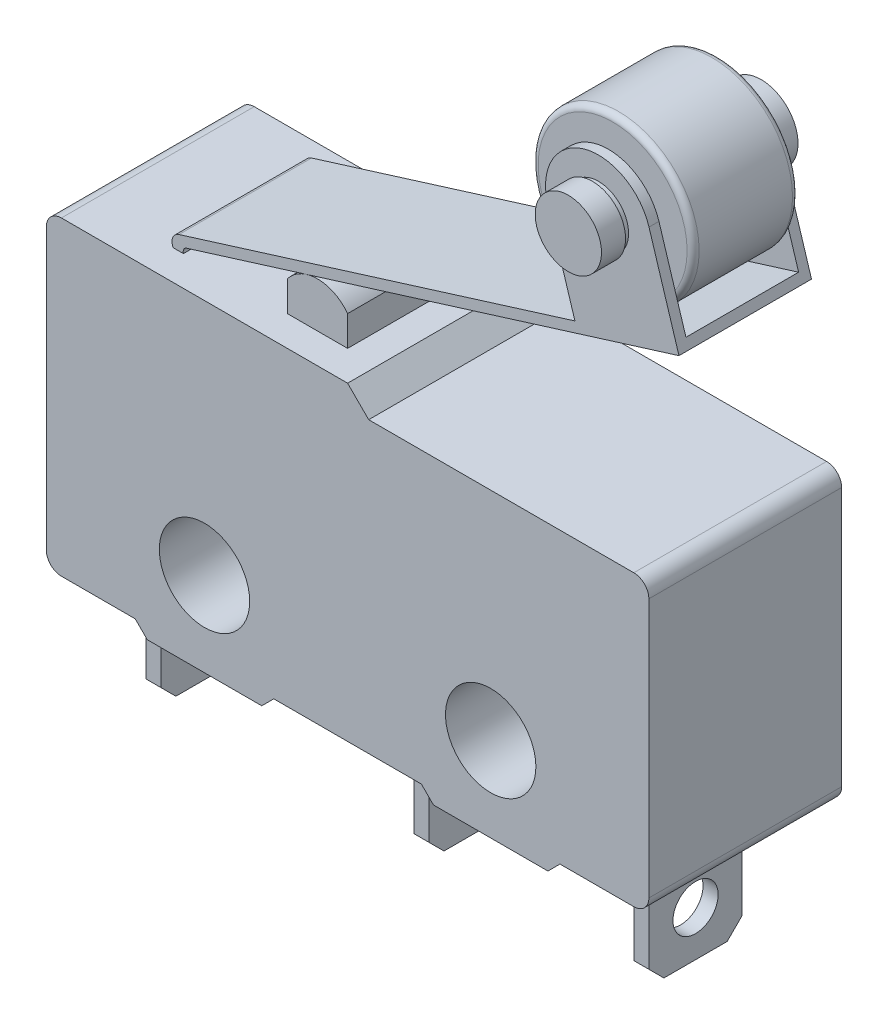
from build123d import *

# Parameters (mm, degrees)
ESBO_O2_R                 = 1.5
RESSALTO_EXTRUS_O1_DEPTH  = 6.4
RESSALTO_EXTRUS_O2_DEPTH  = 4.4
ESBO_O4_W                 = 0.5
ESBO_O4_H                 = 3.7
RESSALTO_EXTRUS_O4_DEPTH  = 3.1
ESBO_O6_R                 = 0.75
CORTE_EXTRUS_O1_DEPTH     = 23.1
RESSALTO_EXTRUS_O15_DEPTH = 4.4
RESSALTO_EXTRUS_O16_DEPTH = 0.33
RESSALTO_EXTRUS_O17_DEPTH = 0.33
RESSALTO_EXTRUS_O18_START = -6.4
ESBO_O10_R                = 1
RESSALTO_EXTRUS_O18_DEPTH = 6.4
ESBO_O11_R                = 1.225
RESSALTO_EXTRUS_O19_DEPTH = 0.8
ESBO_O12_R                = 1.1
RESSALTO_EXTRUS_O20_DEPTH = 0.8
ESBO_O13_R                = 2.672557582
RESSALTO_EXTRUS_O21_DEPTH = 3.5
FILETE1_R                 = 0.2


with BuildPart() as part:
    # Esboço2 → Ressalto-extrusão1 (new body)
    with BuildSketch(Plane.XY):
        with BuildLine():
            Line((4.026483681, -3.219711224), (6.476483681, -3.219711224))
            ThreePointArc((6.476483681, -3.219711224), (6.830037072, -3.073264614), (6.976483681, -2.719711224))
            Line((6.976483681, -2.719711224), (6.976483681, 5.880288776))
            ThreePointArc((6.976483681, 5.880288776), (6.830037072, 6.233842167), (6.476483681, 6.380288776))
            Line((6.476483681, 6.380288776), (-2.323516319, 6.380288776))
            Line((-2.323516319, 6.380288776), (-3.023516319, 7.080288776))
            Line((-3.023516319, 7.080288776), (-12.523516319, 7.080288776))
            ThreePointArc((-12.523516319, 7.080288776), (-12.877069709, 6.933842167), (-13.023516319, 6.580288776))
            Line((-13.023516319, 6.580288776), (-13.023516319, -2.719711224))
            ThreePointArc((-13.023516319, -2.719711224), (-12.877069709, -3.073264614), (-12.523516319, -3.219711224))
            Line((-12.523516319, -3.219711224), (-10.073516319, -3.219711224))
            Line((-10.073516319, -3.219711224), (-9.673516319, -3.619711224))
            Line((-9.673516319, -3.619711224), (-5.873516319, -3.619711224))
            Line((-5.873516319, -3.619711224), (-5.473516319, -3.219711224))
            Line((-5.473516319, -3.219711224), (-0.573516319, -3.219711224))
            Line((-0.573516319, -3.219711224), (-0.173516319, -3.619711224))
            Line((-0.173516319, -3.619711224), (3.626483681, -3.619711224))
            Line((3.626483681, -3.619711224), (4.026483681, -3.219711224))
        make_face()
        with Locations((1.726483681, -0.819711224)):
            Circle(ESBO_O2_R, mode=Mode.SUBTRACT)
        with Locations((-7.773516319, -0.819711224)):
            Circle(ESBO_O2_R, mode=Mode.SUBTRACT)
    extrude(amount=RESSALTO_EXTRUS_O1_DEPTH)

    # Esboço3 → Ressalto-extrusão2 (add)
    with BuildSketch(Plane(origin=(0, 0, 1), x_dir=(-1, 0, 0), z_dir=(0, 0, -1))):
        with BuildLine():
            Line((4.023516319, 7.080288776), (6.023516319, 7.080288776))
            Line((6.023516319, 7.080288776), (6.023516319, 8.080288776))
            ThreePointArc((6.023516319, 8.080288776), (5.023516319, 8.580288776), (4.023516319, 8.080288776))
            Line((4.023516319, 8.080288776), (4.023516319, 7.080288776))
        make_face()
    extrude(amount=-RESSALTO_EXTRUS_O2_DEPTH)

    # Esboço4 → Ressalto-extrusão4 (add)
    with BuildSketch(Plane(origin=(0, 0, 1.65), x_dir=(-1, 0, 0), z_dir=(0, 0, -1))):
        with Locations((11.123516319, -5.069711224)):
            Rectangle(ESBO_O4_W, ESBO_O4_H)
        with Locations((2.223516319, -5.069711224)):
            Rectangle(ESBO_O4_W, ESBO_O4_H)
        with Locations((-5.076483681, -5.069711224)):
            Rectangle(ESBO_O4_W, ESBO_O4_H)
    extrude(amount=-RESSALTO_EXTRUS_O4_DEPTH)

    # Esboço6 → Corte-extrusão1 (cut)
    with BuildSketch(Plane.ZY.offset(11.373516319)):
        with Locations((3.2, -5.419711224)):
            Circle(ESBO_O6_R)
        Polygon((1.65, -6.419711224), (2.15, -6.919711224), (4.25, -6.919711224), (4.75, -6.419711224), (4.75, -4.307213544), (5.418573978, -4.307213544), (5.418573978, -7.77930336), (0.93735461, -7.77930336), (0.93735461, -4.307213544), (1.65, -4.307213544), align=None)
    extrude(amount=-CORTE_EXTRUS_O1_DEPTH, mode=Mode.SUBTRACT)


with BuildPart() as body_2:
    # Esboço7 → Ressalto-extrusão15 (new body)
    with BuildSketch(Plane(origin=(0, 0, 1), x_dir=(-1, 0, 0), z_dir=(0, 0, -1))):
        with BuildLine():
            Line((9.365374351, 7.289132915), (-6.976483681, 12.37101291))
            Line((-6.976483681, 12.37101291), (-6.878491341, 12.68612797))
            Line((-6.878491341, 12.68612797), (9.620924222, 7.555251805))
            ThreePointArc((9.620924222, 7.555251805), (9.815042925, 7.393665692), (9.838046941, 7.142144404))
            Line((9.838046941, 7.142144404), (9.818811498, 7.080288776))
            Line((9.818811498, 7.080288776), (9.473223446, 7.080288776))
            Line((9.473223446, 7.080288776), (9.473935711, 7.082579215))
            ThreePointArc((9.473935711, 7.082579215), (9.462433703, 7.208339859), (9.365374351, 7.289132915))
        make_face()
    extrude(amount=-RESSALTO_EXTRUS_O15_DEPTH)

    # Esboço8 → Ressalto-extrusão16 (add)
    with BuildSketch(Plane(origin=(0, 0, 1), x_dir=(-1, 0, 0), z_dir=(0, 0, -1))):
        with BuildLine():
            Line((-3.522926038, 11.642637068), (-6.878491341, 12.68612797))
            Line((-6.878491341, 12.68612797), (-5.981708751, 15.569921721))
            ThreePointArc((-5.981708751, 15.569921721), (-3.782180648, 16.725958922), (-2.626143448, 14.526430819))
            Line((-2.626143448, 14.526430819), (-3.522926038, 11.642637068))
        make_face()
    extrude(amount=-RESSALTO_EXTRUS_O16_DEPTH)

    # Esboço9 → Ressalto-extrusão17 (add)
    with BuildSketch(Plane.XY.offset(5.4)):
        with BuildLine():
            Line((6.878491341, 12.68612797), (5.981708751, 15.569921721))
            ThreePointArc((5.981708751, 15.569921721), (3.782180648, 16.725958922), (2.626143448, 14.526430819))
            Line((2.626143448, 14.526430819), (3.522926038, 11.642637068))
            Line((3.522926038, 11.642637068), (6.878491341, 12.68612797))
        make_face()
    extrude(amount=-RESSALTO_EXTRUS_O17_DEPTH)

    # Esboço10 → Ressalto-extrusão18 (add)
    with BuildSketch(Plane.XY.offset(6.4).offset(RESSALTO_EXTRUS_O18_START)):
        with Locations((4.303926099, 15.04817627)):
            Circle(ESBO_O10_R)
    extrude(amount=RESSALTO_EXTRUS_O18_DEPTH)

    # Esboço11 → Ressalto-extrusão19 (add)
    with BuildSketch(Plane(origin=(0, 0, 0), x_dir=(-1, 0, 0), z_dir=(0, 0, -1))):
        with Locations((-4.303926099, 15.04817627)):
            Circle(ESBO_O11_R)
    extrude(amount=-RESSALTO_EXTRUS_O19_DEPTH)

    # Esboço12 → Ressalto-extrusão20 (add)
    with BuildSketch(Plane.XY.offset(6.4)):
        with Locations((4.303926099, 15.04817627)):
            Circle(ESBO_O12_R)
    extrude(amount=-RESSALTO_EXTRUS_O20_DEPTH)

    # Esboço13 → Ressalto-extrusão21 (add)
    with BuildSketch(Plane.XY.offset(1.43)):
        with Locations((4.303926099, 15.04817627)):
            Circle(ESBO_O13_R)
    extrude(amount=RESSALTO_EXTRUS_O21_DEPTH)

    # Filete1
    filete1_edges = [body_2.edges().sort_by_distance(p)[0] for p in [
        (1.631368517, 15.04817627, 1.43),
        (1.631368517, 15.04817627, 4.93),
    ]]
    fillet(filete1_edges, radius=FILETE1_R)


solid = Compound([part.part, body_2.part])
